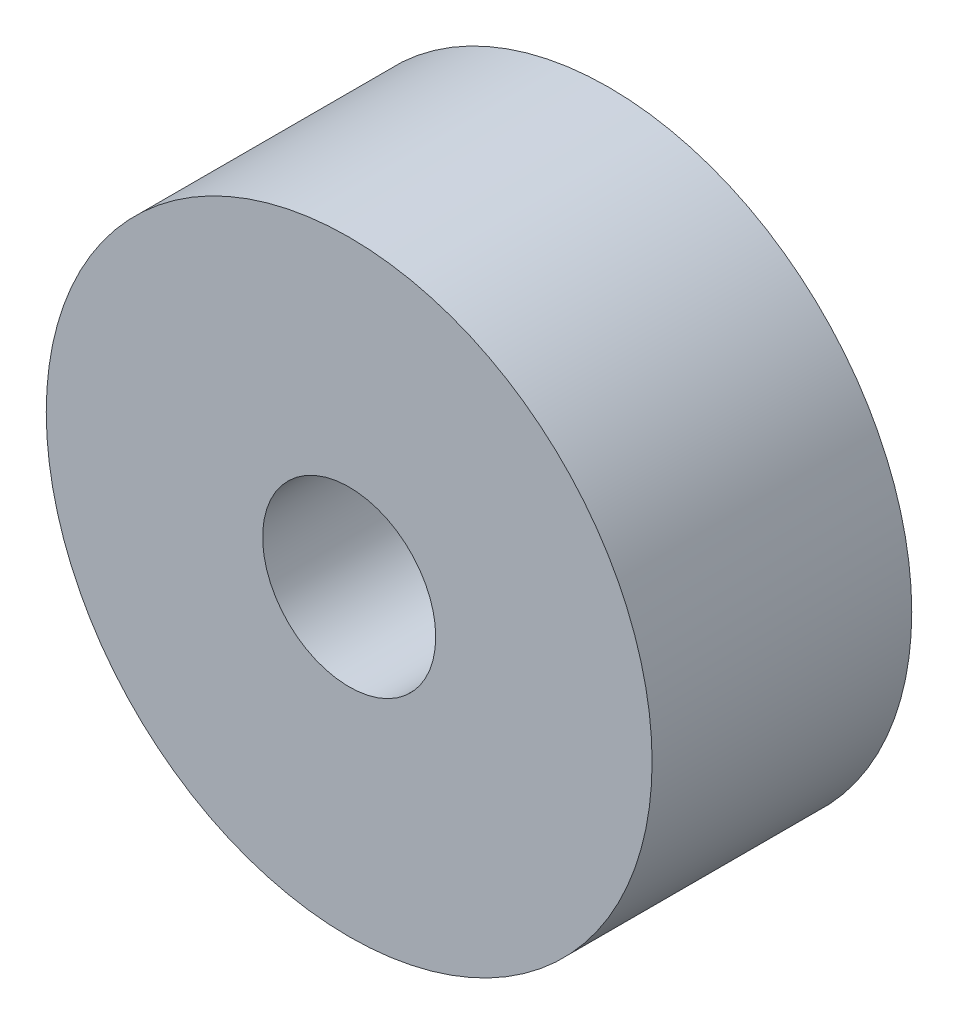
from build123d import *

# Parameters (mm, degrees)
CARRIER_START = -15
SKETCH_1_R    = 35
SKETCH_1_R_2  = 10
CARRIER_DEPTH = 30


with BuildPart() as part:
    # Эскиз1 → Carrier (new body)
    with BuildSketch(Plane.XY.offset(CARRIER_START)):
        Circle(SKETCH_1_R)
        Circle(SKETCH_1_R_2, mode=Mode.SUBTRACT)
    extrude(amount=CARRIER_DEPTH)


solid = part.part
